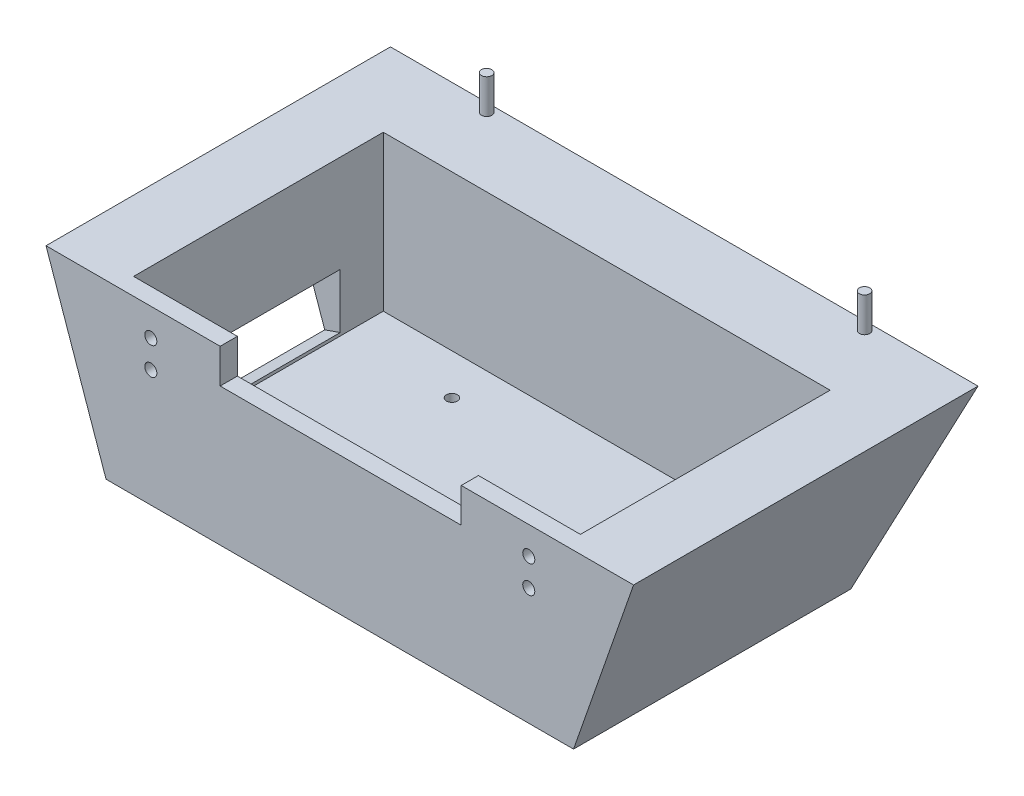
from build123d import *

# Parameters (mm, degrees)
SKETCH3_W           = 135.73
SKETCH3_H           = 80.5
BOSS_EXTRUDE1_DEPTH = 5
SKETCH4_W           = 135.73
SKETCH4_H           = 80.5
SKETCH4_W_2         = 125.73
SKETCH4_H_2         = 70.5
BOSS_EXTRUDE2_DEPTH = 45
SKETCH8_W           = 70
SKETCH8_H           = 5
CUT_EXTRUDE2_DEPTH  = 10
DRAFT3_ANGLE        = 21.30578
DRAFT4_ANGLE        = 19.21855
SKETCH12_R          = 1.75
CUT_EXTRUDE3_DEPTH  = 10
CUT_EXTRUDE4_DEPTH  = 45
SKETCH19_R          = 1.6
CUT_EXTRUDE5_DEPTH  = 10
SKETCH20_W          = 50
SKETCH20_H          = 15
CUT_EXTRUDE6_DEPTH  = 15
SKETCH21_R          = 1.5
BOSS_EXTRUDE3_DEPTH = 10


with BuildPart() as part:
    # Sketch3 → Boss-Extrude1 (new body)
    with BuildSketch(Plane(origin=(0, 0, 0), x_dir=(1, 0, 0), z_dir=(0, 1, 0))):
        with Locations((-10.97491424, -60.714595487)):
            Rectangle(SKETCH3_W, SKETCH3_H)
    extrude(amount=BOSS_EXTRUDE1_DEPTH)

    # Sketch4 → Boss-Extrude2 (add)
    with BuildSketch(Plane(origin=(0, 5, 0), x_dir=(1, 0, 0), z_dir=(0, 1, 0))):
        with Locations((-10.97491424, -60.714595487)):
            Rectangle(SKETCH4_W, SKETCH4_H)
        with Locations((-10.97491424, -60.714595487)):
            Rectangle(SKETCH4_W_2, SKETCH4_H_2, mode=Mode.SUBTRACT)
    extrude(amount=BOSS_EXTRUDE2_DEPTH)

    # Sketch8 → Cut-Extrude2 (cut)
    with BuildSketch(Plane(origin=(0, 50, 0), x_dir=(1, 0, 0), z_dir=(0, 1, 0))):
        with Locations((-10.70991424, -98.464595487)):
            Rectangle(SKETCH8_W, SKETCH8_H)
    extrude(amount=-CUT_EXTRUDE2_DEPTH, mode=Mode.SUBTRACT)

    # Draft3
    draft3_faces = [part.faces().sort_by_distance(p)[0] for p in [
        (-10.97491424, 25, 20.464595487),
    ]]
    draft(draft3_faces, Plane(origin=(0, 0, 0), x_dir=(0, 0, -1), z_dir=(0, -1, 0)), DRAFT3_ANGLE)

    # Draft4
    draft4_faces = [part.faces().sort_by_distance(p)[0] for p in [
        (-78.83991424, 25.900276859, 55.664042442),
        (56.89008576, 25.900276859, 55.664042442),
    ]]
    draft(draft4_faces, Plane(origin=(0, 0, 0), x_dir=(0, 0, -1), z_dir=(0, -1, 0)), DRAFT4_ANGLE)

    # Sketch12 → Cut-Extrude3 (cut)
    with BuildSketch(Plane(origin=(0, 0, 95.964595487), x_dir=(-1, 0, 0), z_dir=(0, 0, -1))):
        with Locations((65.83991424, 42)):
            Circle(SKETCH12_R)
        with Locations((65.83991424, 34)):
            Circle(SKETCH12_R)
        with Locations((-43.89008576, 42)):
            Circle(SKETCH12_R)
        with Locations((-43.89008576, 34)):
            Circle(SKETCH12_R)
    extrude(amount=-CUT_EXTRUDE3_DEPTH, mode=Mode.SUBTRACT)

    # Sketch15 → Cut-Extrude4 (cut)
    with BuildSketch(Plane(origin=(0, 50, 0), x_dir=(1, 0, 0), z_dir=(0, 1, 0))):
        Polygon((-73.83991424, -95.964595487), (-75.83991424, -95.964595487), (-75.83991424, -50.577012028), (-75.83991424, -23.464595487), (53.89008576, -23.464595487), (53.89008576, -95.964595487), (51.89008576, -95.964595487), (51.89008576, -25.464595487), (-73.83991424, -25.464595487), align=None)
    extrude(amount=-CUT_EXTRUDE4_DEPTH, mode=Mode.SUBTRACT)

    # Sketch19 → Cut-Extrude5 (cut)
    with BuildSketch(Plane(origin=(0, 5, 0), x_dir=(1, 0, 0), z_dir=(0, 1, 0))):
        with Locations(Location((-45.339914237, -83.561998038, 0), (0, 0, 270))):
            Circle(SKETCH19_R)
        with Locations(Location((-44.06991424, -35.301998038, 0), (0, 0, 270))):
            Circle(SKETCH19_R)
        with Locations(Location((30.86008576, -35.301998033, 0), (0, 0, 270))):
            Circle(SKETCH19_R)
        with Locations(Location((37.210085763, -83.561998033, 0), (0, 0, 270))):
            Circle(SKETCH19_R)
    extrude(amount=-CUT_EXTRUDE5_DEPTH, mode=Mode.SUBTRACT)

    # Sketch20 → Cut-Extrude6 (cut)
    with BuildSketch(Plane(origin=(-70.297258269, -24.505617582, 0), x_dir=(0, 0, 1), z_dir=(-0.9442698473474347, -0.3291723794464724, 0))):
        with Locations((60.964595487, 38.019061203)):
            Rectangle(SKETCH20_W, SKETCH20_H)
    extrude(amount=-CUT_EXTRUDE6_DEPTH, mode=Mode.SUBTRACT)

    # Sketch21 → Boss-Extrude3 (add)
    with BuildSketch(Plane(origin=(0, 50, 0), x_dir=(1, 0, 0), z_dir=(0, 1, 0))):
        with Locations(Location((-65.839914241, -3.464599124, 0), (0, 0, 270))):
            Circle(SKETCH21_R)
        with Locations(Location((43.890085759, -3.464599124, 0), (0, 0, 270))):
            Circle(SKETCH21_R)
    extrude(amount=BOSS_EXTRUDE3_DEPTH)


solid = part.part
